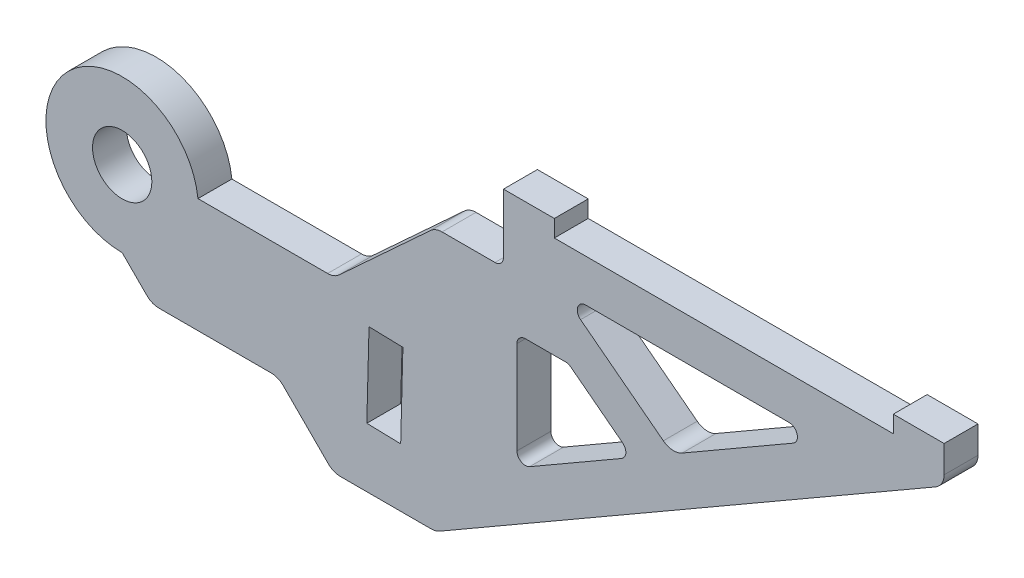
from build123d import *

# Parameters (mm, degrees)
SKETCH1_R           = 1.75
BOSS_EXTRUDE1_DEPTH = 2


with BuildPart() as part:
    # Sketch1 → Boss-Extrude1 (new body)
    with BuildSketch(Plane.XY):
        with BuildLine():
            Line((4.472135955, 0.5), (12.123157342, 0.5))
            ThreePointArc((12.123157342, 0.5), (12.486721612, 0.568430882), (12.800527834, 0.764357957))
            Line((12.800527834, 0.764357957), (18.199472166, 5.735642043))
            ThreePointArc((18.199472166, 5.735642043), (18.513278388, 5.931569118), (18.876842658, 6))
            Line((18.876842658, 6), (22, 6))
            ThreePointArc((22, 6), (22.353553391, 6.146446609), (22.5, 6.5))
            Line((22.5, 6.5), (22.5, 10))
            Line((22.5, 10), (25.5, 10))
            Line((25.5, 10), (25.5, 9))
            Line((25.5, 9), (45.5, 9))
            Line((45.5, 9), (45.5, 10))
            Line((45.5, 10), (48.5, 10))
            Line((48.5, 10), (48.5, 8.397324532))
            ThreePointArc((48.5, 8.397324532), (48.366025404, 7.897324532), (48, 7.531299129))
            Line((48, 7.531299129), (25.723862599, -5.329834796))
            Line((25.723862599, -5.329834796), (18.732975398, -9.366025404))
            ThreePointArc((18.732975398, -9.366025404), (18.491794443, -9.465925826), (18.232975398, -9.5))
            Line((18.232975398, -9.5), (12.871682623, -9.5))
            ThreePointArc((12.871682623, -9.5), (12.48899919, -9.423879533), (12.164575841, -9.207106781))
            Line((12.164575841, -9.207106781), (9.500810677, -6.543341617))
            ThreePointArc((9.500810677, -6.543341617), (9.176387328, -6.326568865), (8.793703896, -6.250448398))
            Line((8.793703896, -6.250448398), (2.16466196, -6.250448398))
            ThreePointArc((2.16466196, -6.250448398), (1.781978528, -6.17432793), (1.457555179, -5.957555179))
            Line((1.457555179, -5.957555179), (0, -4.5))
            ThreePointArc((0, -4.5), (-3.354101966, 3), (4.472135955, 0.5))
        make_face()
        Circle(SKETCH1_R, mode=Mode.SUBTRACT)
        with BuildLine():
            Line((27.801871392, 6.5), (39.347712108, 6.5))
            ThreePointArc((39.347712108, 6.5), (39.830675021, 6.129409523), (39.597712108, 5.566987298))
            Line((39.597712108, 5.566987298), (33.04143505, 1.781718974))
            ThreePointArc((33.04143505, 1.781718974), (32.475981159, 1.649888783), (31.932592907, 1.854452979))
            Line((31.932592907, 1.854452979), (27.047958678, 5.6033543))
            ThreePointArc((27.047958678, 5.6033543), (26.878922862, 6.160743818), (27.35237975, 6.5))
            Line((27.35237975, 6.5), (27.801871392, 6.5))
        make_face(mode=Mode.SUBTRACT)
        with BuildLine():
            Line((29.525805665, 0.550207783), (26.468512346, 2.8966457))
            ThreePointArc((26.468512346, 2.8966457), (26.324835093, 2.973456888), (26.164091274, 3))
            Line((26.164091274, 3), (23.793857984, 3))
            ThreePointArc((23.793857984, 3), (23.440304593, 2.853553391), (23.293857984, 2.5))
            Line((23.293857984, 2.5), (23.293857984, -2.980021865))
            ThreePointArc((23.293857984, -2.980021865), (23.543857984, -3.413034567), (24.043857984, -3.413034567))
            Line((24.043857984, -3.413034567), (29.471384593, -0.279450618))
            ThreePointArc((29.471384593, -0.279450618), (29.72031239, 0.120835138), (29.525805665, 0.550207783))
        make_face(mode=Mode.SUBTRACT)
        Polygon((14.565442371, -1.000856688), (14.434557629, -5.999143312), (16.433872279, -6.051497209), (16.564757021, -1.053210584), align=None, mode=Mode.SUBTRACT)
    extrude(amount=BOSS_EXTRUDE1_DEPTH)


solid = part.part
